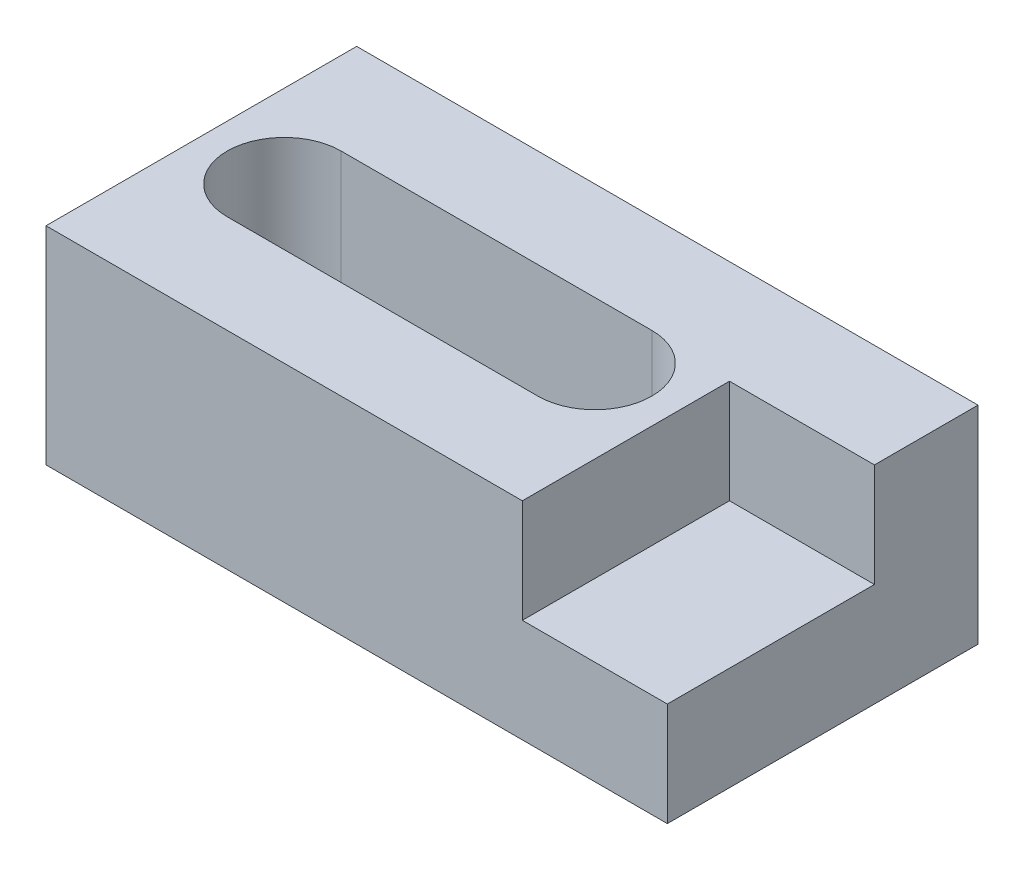
from build123d import *

# Parameters (mm, degrees)
SKETCH1_W               = 30
SKETCH1_H               = 15
BOSS_EXTRUDE1_DEPTH     = 10
CUT_EXTRUDE1_DEPTH      = 24.452078799
CUT_EXTRUDE1_DEPTH_BACK = 24.452078799
SKETCH2_W               = 7
SKETCH2_H               = 5
SKETCH3_W               = 7
SKETCH3_H               = 5
BOSS_EXTRUDE2_DEPTH     = 5


with BuildPart() as part:
    # Sketch1 → Boss-Extrude1 (new body)
    with BuildSketch(Plane(origin=(0, 0, 0), x_dir=(1, 0, 0), z_dir=(0, 1, 0))):
        Rectangle(SKETCH1_W, SKETCH1_H)
        with BuildLine():
            Line((-11, 2.75), (4, 2.75))
            ThreePointArc((4, 2.75), (6.75, 0), (4, -2.75))
            Line((4, -2.75), (-11, -2.75))
            ThreePointArc((-11, -2.75), (-13.75, 0), (-11, 2.75))
        make_face(mode=Mode.SUBTRACT)
    extrude(amount=BOSS_EXTRUDE1_DEPTH)

    # Sketch2 → Cut-Extrude1 (cut, two sides: drawn at the far end of the back side and taken through both)
    with BuildSketch(Plane.XY.offset(7.5).offset(-CUT_EXTRUDE1_DEPTH_BACK)):
        with Locations((11.5, 7.5)):
            Rectangle(SKETCH2_W, SKETCH2_H)
    extrude(amount=CUT_EXTRUDE1_DEPTH + CUT_EXTRUDE1_DEPTH_BACK, mode=Mode.SUBTRACT)

    # Sketch3 → Boss-Extrude2 (add)
    with BuildSketch(Plane(origin=(0, 5, 0), x_dir=(1, 0, 0), z_dir=(0, 1, 0))):
        with Locations((11.5, 5)):
            Rectangle(SKETCH3_W, SKETCH3_H)
    extrude(amount=BOSS_EXTRUDE2_DEPTH)


solid = part.part
